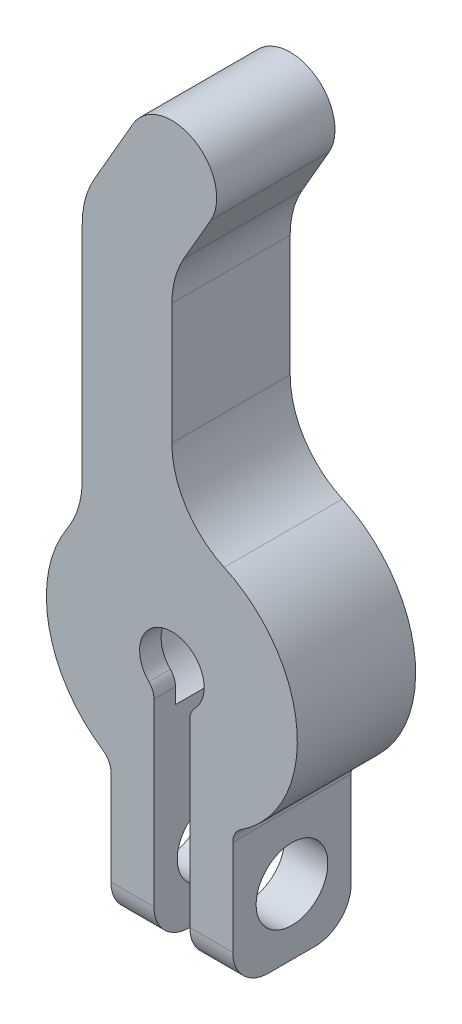
from build123d import *

# Parameters (mm, degrees)
BOSS_EXTRUDE1_DEPTH = 2.7
BOSS_EXTRUDE2_DEPTH = 0.6
FILLET1_R           = 0.5
FILLET2_R           = 2.5
FILLET3_R           = 0.5
FILLET4_R           = 1
SKETCH3_R           = 1
CUT_EXTRUDE1_DEPTH  = 15.611382549


with BuildPart() as part:
    # Sketch1 → Boss-Extrude1 (new body)
    with BuildSketch(Plane.XY):
        with BuildLine():
            Line((-1.082531755, 12.625), (-2.5, 10.169872981))
            Line((-2.5, 10.169872981), (-2.5, 2.449489743))
            ThreePointArc((-2.5, 2.449489743), (-3.463668402, -0.502992247), (-1.7, -3.059411708))
            Line((-1.7, -3.059411708), (-1.7, -7))
            Line((-1.7, -7), (-0.5, -7))
            Line((-0.5, -7), (-0.5, -1.414213562))
            ThreePointArc((-0.5, -1.414213562), (0, 1.5), (0.5, -1.414213562))
            Line((0.5, -1.414213562), (0.5, -7))
            Line((0.5, -7), (1.7, -7))
            Line((1.7, -7), (1.7, -3.059411708))
            ThreePointArc((1.7, -3.059411708), (3.388062941, 0.878082861), (0, 3.5))
            Line((0, 3.5), (0, 9.5))
            Line((0, 9.5), (1.082531755, 11.375))
            ThreePointArc((1.082531755, 11.375), (0.625, 13.082531755), (-1.082531755, 12.625))
        make_face()
    extrude(amount=BOSS_EXTRUDE1_DEPTH)

    # Sketch2 → Boss-Extrude2 (add)
    with BuildSketch(Plane.XY.offset(2.7)):
        with BuildLine():
            Line((0.5, -0.748331477), (0.5, -7))
            Line((0.5, -7), (1.7, -7))
            Line((1.7, -7), (1.7, -3.059411708))
            ThreePointArc((1.7, -3.059411708), (3.388062941, 0.878082861), (0, 3.5))
            Line((0, 3.5), (0, 9.5))
            Line((0, 9.5), (1.082531755, 11.375))
            ThreePointArc((1.082531755, 11.375), (0.625, 13.082531755), (-1.082531755, 12.625))
            Line((-1.082531755, 12.625), (-2.5, 10.169872981))
            Line((-2.5, 10.169872981), (-2.5, 2.449489743))
            ThreePointArc((-2.5, 2.449489743), (-3.463668402, -0.502992247), (-1.7, -3.059411708))
            Line((-1.7, -3.059411708), (-1.7, -7))
            Line((-1.7, -7), (-0.5, -7))
            Line((-0.5, -7), (-0.5, -0.748331477))
            ThreePointArc((-0.5, -0.748331477), (0, 0.9), (0.5, -0.748331477))
        make_face()
    extrude(amount=BOSS_EXTRUDE2_DEPTH)

    # Fillet1
    fillet1_edges = [part.edges().sort_by_distance(p)[0] for p in [
        (-0.5, -0.748331477, 3),
        (0.5, -0.748331477, 3),
    ]]
    fillet(fillet1_edges, radius=FILLET1_R)

    # Fillet2
    fillet2_edges = [part.edges().sort_by_distance(p)[0] for p in [
        (-2.5, 2.449489743, 1.65),
        (-2.5, 10.169872981, 1.65),
        (0, 9.5, 1.65),
        (0, 3.5, 1.65),
    ]]
    fillet(fillet2_edges, radius=FILLET2_R)

    # Fillet3
    fillet3_edges = [part.edges().sort_by_distance(p)[0] for p in [
        (-1.7, -3.059411708, 1.65),
        (1.7, -3.059411708, 1.65),
    ]]
    fillet(fillet3_edges, radius=FILLET3_R)

    # Fillet4
    fillet4_edges = [part.edges().sort_by_distance(p)[0] for p in [
        (-1.1, -7, 0),
        (1.1, -7, 0),
        (1.1, -7, 3.3),
        (-1.1, -7, 3.3),
    ]]
    fillet(fillet4_edges, radius=FILLET4_R)

    # Sketch3 → Cut-Extrude1 (cut, through all)
    with BuildSketch(Plane.ZY.offset(1.7)):
        with Locations((1.65, -5.170329309)):
            Circle(SKETCH3_R)
    extrude(amount=-CUT_EXTRUDE1_DEPTH, mode=Mode.SUBTRACT)


solid = part.part
